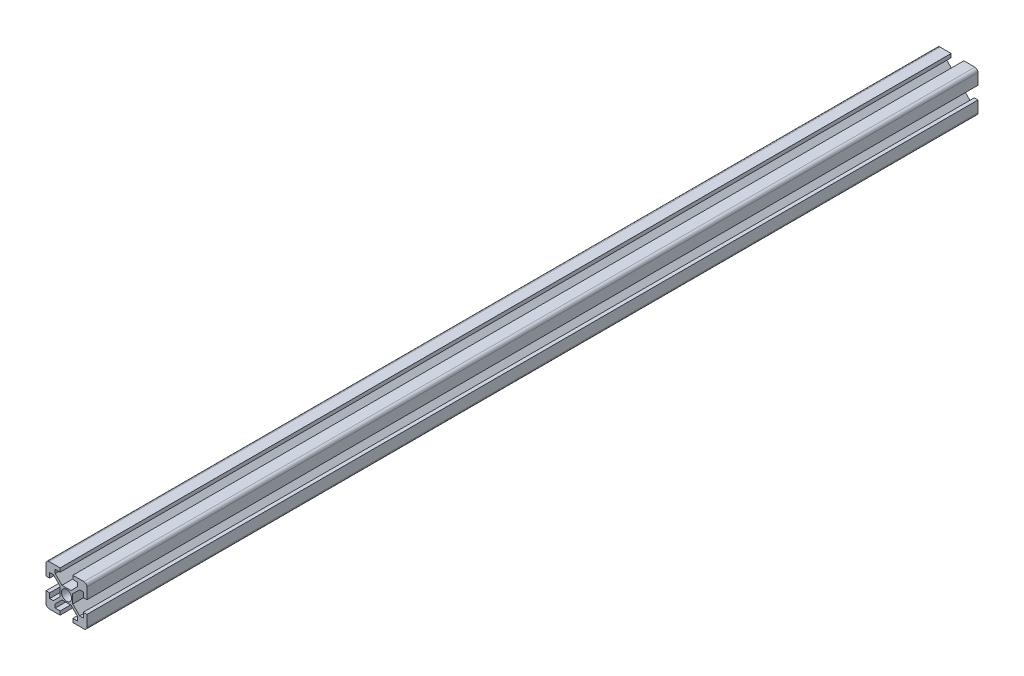
from build123d import *

# Parameters (mm, degrees)
SKETCH_1_R      = 2.5
EXTRUDE_1_DEPTH = 435


with BuildPart() as part:
    # 草图1 → 凸台-拉伸1 (new body)
    with BuildSketch(Plane.XY):
        with BuildLine():
            Line((-8.2, -3.1), (-10, -3.1))
            Line((-10, -3.1), (-10, -8.5))
            ThreePointArc((-10, -8.5), (-9.560660172, -9.560660172), (-8.5, -10))
            Line((-8.5, -10), (-3.1, -10))
            Line((-3.1, -10), (-3.1, -8.2))
            Line((-3.1, -8.2), (-5.5, -8.2))
            Line((-5.5, -8.2), (-5.5, -6.397050155))
            Line((-5.5, -6.397050155), (-2.202949845, -3.1))
            Line((-2.202949845, -3.1), (2.202949845, -3.1))
            Line((2.202949845, -3.1), (5.5, -6.397050155))
            Line((5.5, -6.397050155), (5.5, -8.2))
            Line((5.5, -8.2), (3.1, -8.2))
            Line((3.1, -8.2), (3.1, -10))
            Line((3.1, -10), (8.5, -10))
            ThreePointArc((8.5, -10), (9.560660172, -9.560660172), (10, -8.5))
            Line((10, -8.5), (10, -3.1))
            Line((10, -3.1), (8.2, -3.1))
            Line((8.2, -3.1), (8.2, -5.5))
            Line((8.2, -5.5), (6.397050155, -5.5))
            Line((6.397050155, -5.5), (3.05412702, -2.157076865))
            Line((3.05412702, -2.157076865), (3.05412702, 2.157076865))
            Line((3.05412702, 2.157076865), (6.397050155, 5.5))
            Line((6.397050155, 5.5), (8.2, 5.5))
            Line((8.2, 5.5), (8.2, 3.1))
            Line((8.2, 3.1), (10, 3.1))
            Line((10, 3.1), (10, 8.5))
            ThreePointArc((10, 8.5), (9.560660172, 9.560660172), (8.5, 10))
            Line((8.5, 10), (3.1, 10))
            Line((3.1, 10), (3.1, 8.2))
            Line((3.1, 8.2), (5.5, 8.2))
            Line((5.5, 8.2), (5.5, 6.397050155))
            Line((5.5, 6.397050155), (2.202949845, 3.1))
            Line((2.202949845, 3.1), (-2.202949845, 3.1))
            Line((-2.202949845, 3.1), (-5.5, 6.397050155))
            Line((-5.5, 6.397050155), (-5.5, 8.2))
            Line((-5.5, 8.2), (-3.1, 8.2))
            Line((-3.1, 8.2), (-3.1, 10))
            Line((-3.1, 10), (-8.5, 10))
            ThreePointArc((-8.5, 10), (-9.560660172, 9.560660172), (-10, 8.5))
            Line((-10, 8.5), (-10, 3.1))
            Line((-10, 3.1), (-8.2, 3.1))
            Line((-8.2, 3.1), (-8.2, 5.5))
            Line((-8.2, 5.5), (-6.397050155, 5.5))
            Line((-6.397050155, 5.5), (-3.05412702, 2.157076865))
            Line((-3.05412702, 2.157076865), (-3.05412702, -2.157076865))
            Line((-3.05412702, -2.157076865), (-6.397050155, -5.5))
            Line((-6.397050155, -5.5), (-8.2, -5.5))
            Line((-8.2, -5.5), (-8.2, -3.1))
        make_face()
        with Locations(Location((0, 0, 0), (0, 0, 180))):
            Circle(SKETCH_1_R, mode=Mode.SUBTRACT)
    extrude(amount=EXTRUDE_1_DEPTH)


solid = part.part
